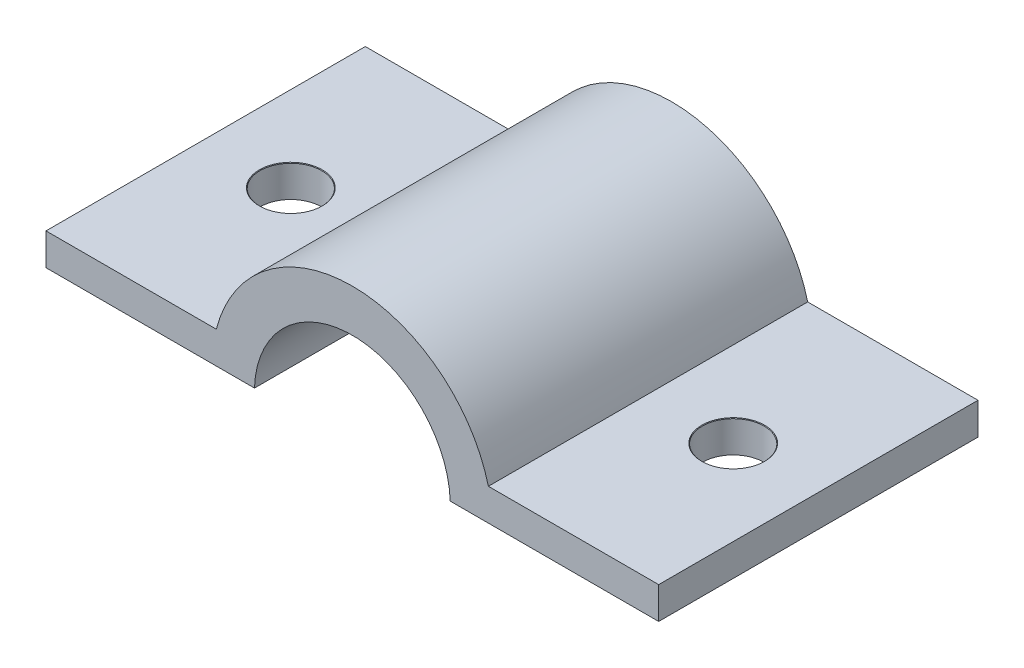
from build123d import *

# Parameters (mm, degrees)
BOSS_EXTRUDE1_DEPTH              = 15
M2_5_CLEARANCE_HOLE1_D           = 2.9
M2_5_CLEARANCE_HOLE1_CSINK_D     = 2.95
M2_5_CLEARANCE_HOLE1_CSINK_ANGLE = 90


with BuildPart() as part:
    # Sketch1 → Boss-Extrude1 (new body)
    with BuildSketch(Plane.XY):
        with BuildLine():
            Line((-14.390422521, 0), (-4.597553697, 0))
            ThreePointArc((-4.597553697, 0), (0, 4.45), (4.597553697, 0))
            Line((4.597553697, 0), (14.390422521, 0))
            Line((14.390422521, 0), (14.390422521, 1.5))
            Line((14.390422521, 1.5), (6.390422521, 1.5))
            ThreePointArc((6.390422521, 1.5), (0, 6.45), (-6.390422521, 1.5))
            Line((-6.390422521, 1.5), (-14.390422521, 1.5))
            Line((-14.390422521, 1.5), (-14.390422521, 0))
        make_face()
    extrude(amount=BOSS_EXTRUDE1_DEPTH)

    # M2.5 Clearance Hole1 (through all)
    with Locations(Plane(origin=(0, 1.5, 0), x_dir=(1, 0, 0), z_dir=(0, 1, 0))):
        with Locations((-10.390422521, -7.5), (10.390422521, -7.5)):
            CounterSinkHole(M2_5_CLEARANCE_HOLE1_D / 2, M2_5_CLEARANCE_HOLE1_CSINK_D / 2, counter_sink_angle=M2_5_CLEARANCE_HOLE1_CSINK_ANGLE)


solid = part.part
